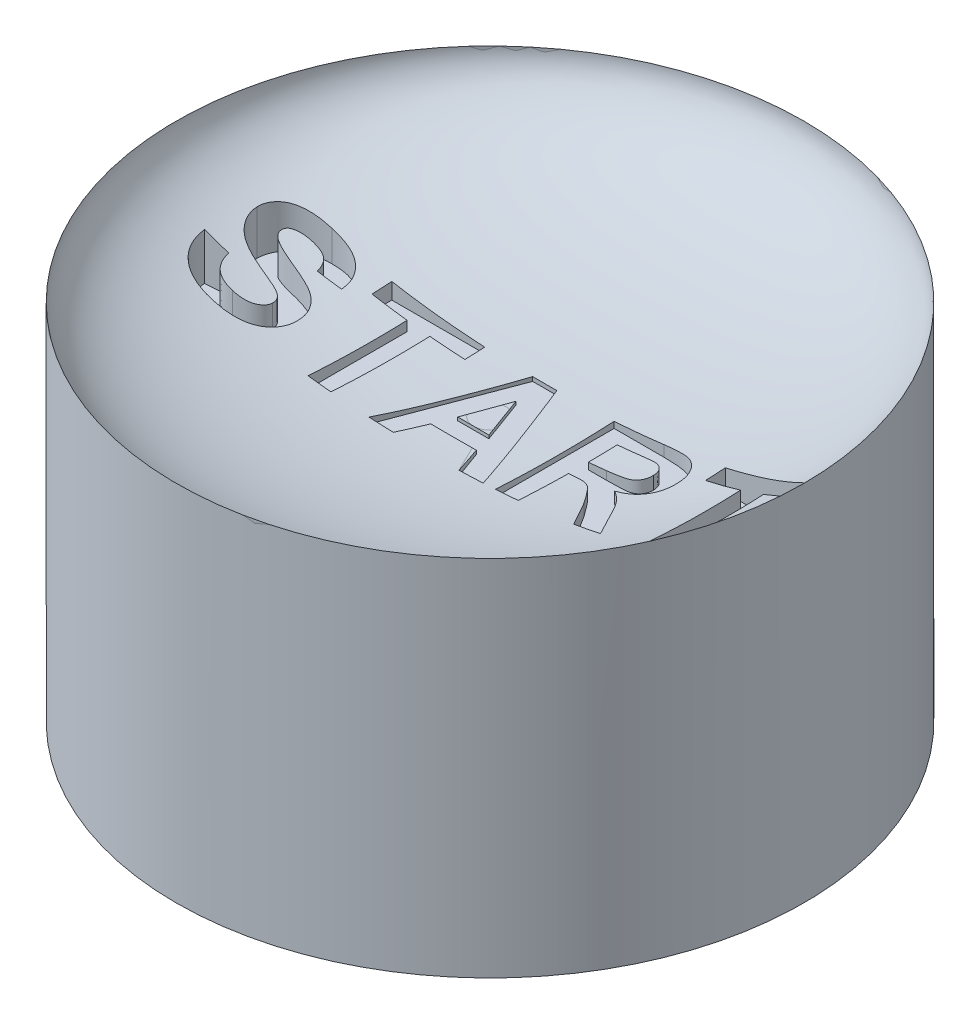
from build123d import *

# Parameters (mm, degrees)
SKETCH1_R           = 9.5
BOSS_EXTRUDE1_DEPTH = 8
CUT_EXTRUDE1_DEPTH  = 2.1


with BuildPart() as part:
    # Sketch1 → Boss-Extrude1 (new body)
    with BuildSketch(Plane(origin=(0, 0, 0), x_dir=(1, 0, 0), z_dir=(0, 1, 0))):
        with Locations(Location((0, 0, 0), (0, 0, 270))):
            Circle(SKETCH1_R)
    extrude(amount=BOSS_EXTRUDE1_DEPTH)

    # Sketch6 → Revolve4 (revolve)
    with BuildSketch(Plane(origin=(0, 0, 0), x_dir=(0, 0, -1), z_dir=(1, 0, 0)), mode=Mode.PRIVATE) as revolve4_sk:
        with BuildLine():
            Line((-9.5, 8), (-9.5, 11))
            add(Edge.make_bspline(
                [(-9.5, 11), (-9.5, 8), (-0.5, 8)],
                knots=[3.141592654, 3.141592654, 3.141592654, 4.71238898, 4.71238898, 4.71238898], degree=2, weights=[1, 0.707106781, 1]))
            Line((-0.5, 8), (-9.5, 8))
        make_face()
    revolve(revolve4_sk.sketch.rotate(Axis((0, 8, 0), (0, 1, 0)), 180), axis=Axis((0, 8, 0), (0, 1, 0)))

    # Sketch7 → Cut-Extrude1 (cut)
    # profile 1 of 5: a face of its own
    with BuildSketch(Plane(origin=(0, 10, 0), x_dir=(1, 0, 0), z_dir=(0, 1, 0))):
        with BuildLine():
            Line((-7.914500021, -0.728793614), (-7.223029606, -0.682695586))
            add(Edge.make_bspline(
                [(-7.223029606, -0.682695586), (-7.217520857, -0.711624273), (-7.206820462, -0.767816408), (-7.183046194, -0.847897872), (-7.156877305, -0.922556508), (-7.125604049, -0.990991728), (-7.091367822, -1.054468519), (-7.051356104, -1.111178579), (-7.008360214, -1.162932517), (-6.960251774, -1.207871552), (-6.907838253, -1.247229779), (-6.850858113, -1.280795787), (-6.789928782, -1.309847773), (-6.724901282, -1.333771162), (-6.655105404, -1.351630089), (-6.581149173, -1.364335656), (-6.502926521, -1.372471951), (-6.449467568, -1.373592075), (-6.422076375, -1.374166001)],
                knots=[0, 0, 0, 0, 1.204560339, 2.339781841, 3.415289417, 4.440034832, 5.416475564, 6.362424008, 7.275913008, 8.16578645, 9.05021719, 9.95355393, 10.867835453, 11.809845306, 12.784702352, 13.812224031, 14.87903166, 16, 16, 16, 16], degree=3))
            add(Edge.make_bspline(
                [(-6.422076375, -1.374166001), (-6.393245412, -1.373851457), (-6.337167703, -1.373239653), (-6.255904902, -1.365649683), (-6.179920493, -1.354776235), (-6.109885444, -1.337563822), (-6.044491916, -1.318314461), (-5.985364014, -1.291979285), (-5.931544908, -1.261605466), (-5.883173247, -1.227139051), (-5.840959253, -1.188913324), (-5.804028344, -1.149006906), (-5.771863963, -1.108281957), (-5.746548318, -1.064931282), (-5.726060706, -1.020708163), (-5.712519829, -0.974293347), (-5.703372165, -0.926752618), (-5.702323195, -0.894261771), (-5.701794692, -0.877891922)],
                knots=[0, 0, 0, 0, 1.417779877, 2.757654889, 4.012140507, 5.189587551, 6.302846416, 7.360586765, 8.365575446, 9.33904572, 10.275781718, 11.161696098, 12.012180333, 12.822428111, 13.625933072, 14.403138519, 15.195454004, 16, 16, 16, 16], degree=3))
            add(Edge.make_bspline(
                [(-5.701794692, -0.877891922), (-5.702442856, -0.857381829), (-5.703710892, -0.817256834), (-5.71897678, -0.759893758), (-5.741870438, -0.706748526), (-5.776340376, -0.658606093), (-5.822676456, -0.614610925), (-5.881782744, -0.573454522), (-5.9553091, -0.536429857), (-6.009856092, -0.515777429), (-6.03888652, -0.504786011)],
                knots=[0, 0, 0, 0, 0.90494901, 1.770400303, 2.607161909, 3.452839393, 4.36912122, 5.420987164, 6.627424851, 8, 8, 8, 8], degree=3))
            add(Edge.make_bspline(
                [(-6.03888652, -0.504786011), (-6.051342708, -0.500611885), (-6.079217633, -0.491270869), (-6.126769296, -0.477914096), (-6.184046538, -0.461235037), (-6.25187705, -0.442276623), (-6.330238024, -0.422887156), (-6.418254273, -0.399001533), (-6.51699881, -0.375233386), (-6.586080607, -0.357687745), (-6.622314683, -0.348484886)],
                knots=[0, 0, 0, 0, 0.521821638, 1.167752076, 1.961721917, 2.891982557, 3.96540661, 5.168436773, 6.514817513, 8, 8, 8, 8], degree=3))
            add(Edge.make_bspline(
                [(-6.622314683, -0.348484886), (-6.669502203, -0.336703263), (-6.760542806, -0.313972549), (-6.890387554, -0.273536219), (-7.009976942, -0.233360487), (-7.118159517, -0.189767662), (-7.216128579, -0.145712146), (-7.302299447, -0.098100951), (-7.378470319, -0.049406696), (-7.422856855, -0.01301142), (-7.444156082, 0.004453139)],
                knots=[0, 0, 0, 0, 1.293880989, 2.496331788, 3.617634808, 4.64976062, 5.598842568, 6.473791081, 7.267636666, 8, 8, 8, 8], degree=3))
            add(Edge.make_bspline(
                [(-7.444156082, 0.004453139), (-7.470569893, 0.029184276), (-7.522356612, 0.077671958), (-7.590525789, 0.157346525), (-7.64780646, 0.241509958), (-7.694954724, 0.329541017), (-7.731257995, 0.421946494), (-7.756989287, 0.518107866), (-7.773643513, 0.618276102), (-7.775342962, 0.686493044), (-7.776205938, 0.721133413)],
                knots=[0, 0, 0, 0, 1.064429417, 2.086912298, 3.078678339, 4.055528992, 5.020032834, 5.993708893, 6.981211098, 8, 8, 8, 8], degree=3))
            add(Edge.make_bspline(
                [(-7.776205938, 0.721133413), (-7.774525286, 0.765957637), (-7.771191375, 0.854875516), (-7.74061724, 0.985572662), (-7.692991091, 1.111685341), (-7.637756051, 1.211823479), (-7.584687095, 1.287578358), (-7.540617191, 1.341939367), (-7.492202143, 1.392816045), (-7.438778769, 1.438967349), (-7.38233081, 1.483096626), (-7.320671255, 1.522283952), (-7.25554834, 1.559196245), (-7.161308062, 1.602954052), (-7.033355623, 1.648553984), (-6.866882627, 1.686991833), (-6.685626499, 1.710097945), (-6.559961067, 1.712932577), (-6.494824825, 1.714401853)],
                knots=[0, 0, 0, 0, 1.180131776, 2.341029169, 3.518901375, 4.725685298, 5.343762192, 5.955650671, 6.568945152, 7.192346361, 7.815201106, 8.455999361, 9.116257477, 9.787318263, 11.192748436, 12.688084276, 14.283332633, 16, 16, 16, 16], degree=3))
            add(Edge.make_bspline(
                [(-6.494824825, 1.714401853), (-6.441491214, 1.713688649), (-6.337758482, 1.712301482), (-6.187385837, 1.698274232), (-6.046929628, 1.676442475), (-5.916882732, 1.645103089), (-5.797184557, 1.603695536), (-5.687371117, 1.55437131), (-5.587535726, 1.495811078), (-5.498893783, 1.427678782), (-5.419922309, 1.352567295), (-5.351032327, 1.270523752), (-5.291960457, 1.182584313), (-5.242325458, 1.088813242), (-5.203347224, 0.98872842), (-5.174719249, 0.882454732), (-5.155784459, 0.77024232), (-5.151038396, 0.693353255), (-5.14861836, 0.654147216)],
                knots=[0, 0, 0, 0, 1.325124071, 2.577337985, 3.749592149, 4.855247722, 5.896868755, 6.892903601, 7.842551483, 8.766257401, 9.665194363, 10.546067736, 11.423174165, 12.293291263, 13.177512979, 14.086532529, 15.024315359, 16, 16, 16, 16], degree=3))
            Line((-5.14861836, 0.654147216), (-5.840088775, 0.608049189))
            add(Edge.make_bspline(
                [(-5.840088775, 0.608049189), (-5.844077694, 0.629731847), (-5.85185168, 0.671989091), (-5.868754456, 0.732510051), (-5.887819968, 0.788485036), (-5.910135161, 0.839913687), (-5.937089218, 0.885874868), (-5.966422978, 0.927814542), (-5.998945625, 0.965173886), (-6.035733999, 0.996929882), (-6.075523891, 1.025826536), (-6.120870344, 1.048987874), (-6.169873294, 1.070476497), (-6.224397003, 1.086630672), (-6.28339442, 1.099444744), (-6.34689991, 1.108944264), (-6.41504511, 1.113582464), (-6.461926496, 1.114600694), (-6.486181445, 1.115127493)],
                knots=[0, 0, 0, 0, 1.151066407, 2.24330871, 3.278475654, 4.238599069, 5.165719782, 6.056502506, 6.909492653, 7.744782051, 8.590364415, 9.471203867, 10.39832458, 11.382154319, 12.435022857, 13.550631277, 14.73277401, 16, 16, 16, 16], degree=3))
            add(Edge.make_bspline(
                [(-6.486181445, 1.115127493), (-6.511399967, 1.114662416), (-6.560463728, 1.113757587), (-6.631962706, 1.108204784), (-6.699034111, 1.097954846), (-6.762007351, 1.084611968), (-6.820798308, 1.066459906), (-6.875282916, 1.04432644), (-6.925710444, 1.018268537), (-6.956458952, 0.997767078), (-6.971651299, 0.987637635)],
                knots=[0, 0, 0, 0, 1.186678824, 2.308736671, 3.37120409, 4.377216403, 5.334874112, 6.262130804, 7.141346615, 8, 8, 8, 8], degree=3))
            add(Edge.make_bspline(
                [(-6.971651299, 0.987637635), (-6.989037663, 0.973800529), (-7.022709655, 0.947002348), (-7.058947843, 0.893790272), (-7.080763316, 0.833688827), (-7.083389056, 0.791187012), (-7.084735523, 0.769392286)],
                knots=[0, 0, 0, 0, 1.037857257, 2.010007357, 2.979541333, 4, 4, 4, 4], degree=3))
            add(Edge.make_bspline(
                [(-7.084735523, 0.769392286), (-7.083634358, 0.749023667), (-7.08146524, 0.708900729), (-7.059586888, 0.651905227), (-7.025940963, 0.599094795), (-6.994504364, 0.570407476), (-6.978133834, 0.555468626)],
                knots=[0, 0, 0, 0, 0.98538058, 1.941042925, 2.927803204, 4, 4, 4, 4], degree=3))
            add(Edge.make_bspline(
                [(-6.978133834, 0.555468626), (-6.965141708, 0.545772563), (-6.936109716, 0.524105897), (-6.88292886, 0.496565516), (-6.818738171, 0.466737619), (-6.742074257, 0.437577556), (-6.653446624, 0.408471622), (-6.552849882, 0.378081662), (-6.440222161, 0.347283689), (-6.318434285, 0.31745736), (-6.19478529, 0.288139792), (-6.076790461, 0.256087416), (-5.967072238, 0.224838828), (-5.866139354, 0.192085237), (-5.773471518, 0.160199717), (-5.689518877, 0.127450992), (-5.613704981, 0.095557399), (-5.525297573, 0.051701448), (-5.425096668, -0.007703209), (-5.320074816, -0.094057786), (-5.227196389, -0.19112597), (-5.16248117, -0.282654571), (-5.1180252, -0.361371604), (-5.089400247, -0.424118246), (-5.064637417, -0.490237384), (-5.04448054, -0.559802086), (-5.029871655, -0.632910237), (-5.017781952, -0.70900329), (-5.011605099, -0.788713216), (-5.010755813, -0.843069714), (-5.010324277, -0.870689105)],
                knots=[0, 0, 0, 0, 0.511875881, 1.143829537, 1.88775736, 2.750598373, 3.734912702, 4.837306479, 6.073130119, 7.42648979, 8.801963576, 10.091065733, 11.292408984, 12.408830014, 13.446061236, 14.39066453, 15.257936293, 16.045629259, 17.510392066, 18.929669597, 20.331293837, 21.746891395, 22.460690638, 23.187651344, 23.925159671, 24.69163991, 25.474819891, 26.281170188, 27.126635539, 28, 28, 28, 28], degree=3))
            add(Edge.make_bspline(
                [(-5.010324277, -0.870689105), (-5.010917653, -0.896160359), (-5.012096039, -0.946743801), (-5.020330919, -1.0218224), (-5.033065956, -1.095567741), (-5.051918185, -1.168072274), (-5.076927592, -1.239193367), (-5.105086196, -1.309957494), (-5.140296945, -1.378821438), (-5.180371579, -1.445842235), (-5.224575722, -1.510969591), (-5.274667227, -1.571048094), (-5.327703914, -1.628082107), (-5.387074686, -1.678878043), (-5.449113265, -1.727548878), (-5.516657232, -1.770652587), (-5.588124129, -1.809657628), (-5.66396583, -1.844272788), (-5.744451235, -1.874436772), (-5.829475811, -1.901284814), (-5.919805577, -1.923257874), (-6.014687313, -1.942091555), (-6.114468243, -1.956414083), (-6.219023619, -1.966414537), (-6.32837721, -1.972054191), (-6.402862579, -1.972972564), (-6.440803699, -1.973440361)],
                knots=[0, 0, 0, 0, 0.900570041, 1.788444861, 2.667795364, 3.545012114, 4.433698372, 5.332345486, 6.235991676, 7.164928091, 8.092777575, 9.015680987, 9.928493428, 10.842962589, 11.775229507, 12.714851019, 13.672254427, 14.652424454, 15.660007982, 16.709910502, 17.803296389, 18.945495772, 20.129342395, 21.366102753, 22.658353839, 24, 24, 24, 24], degree=3))
            add(Edge.make_bspline(
                [(-6.440803699, -1.973440361), (-6.495584821, -1.972545966), (-6.602244966, -1.970804558), (-6.757203, -1.955217584), (-6.902543377, -1.931360597), (-7.038029495, -1.89673606), (-7.163826951, -1.85228597), (-7.279878369, -1.797533275), (-7.385622422, -1.732150855), (-7.482368807, -1.657724345), (-7.568828531, -1.572897506), (-7.646573288, -1.479427918), (-7.714554281, -1.376473903), (-7.772726825, -1.264196495), (-7.822561624, -1.143202664), (-7.863660863, -1.013436852), (-7.894606429, -0.874280145), (-7.907754137, -0.778127854), (-7.914500021, -0.728793614)],
                knots=[0, 0, 0, 0, 1.217954099, 2.371385517, 3.459848295, 4.490682126, 5.476952527, 6.422732854, 7.338496285, 8.236688651, 9.131557988, 10.026443255, 10.935708282, 11.869506048, 12.834296687, 13.842423496, 14.892981177, 16, 16, 16, 16], degree=3))
        make_face()
    # profile 2 of 5: a face of its own
    with BuildSketch(Plane(origin=(0, 10, 0), x_dir=(1, 0, 0), z_dir=(0, 1, 0))):
        Polygon((-3.581285419, -1.927342333), (-3.581285419, 1.069029466), (-4.641540056, 1.069029466), (-4.641540056, 1.668303825), (-1.829560367, 1.668303825), (-1.829560367, 1.069029466), (-2.889815004, 1.069029466), (-2.889815004, -1.927342333), align=None)
    # profile 3 of 5: a face of its own
    with BuildSketch(Plane(origin=(0, 10, 0), x_dir=(1, 0, 0), z_dir=(0, 1, 0))):
        Polygon((1.719987764, -1.927342333), (0.986741011, -1.927342333), (0.683502423, -1.097577835), (-0.696557281, -1.097577835), (-0.999795869, -1.927342333), (-1.737364312, -1.927342333), (-0.378192777, 1.668303825), (0.354333694, 1.668303825), align=None)
        Polygon((0.46381651, -0.498303475), (-0.008688274, 0.7924413), (-0.479752495, -0.498303475), align=None, mode=Mode.SUBTRACT)
    # profile 4 of 5: a face of its own
    with BuildSketch(Plane(origin=(0, 10, 0), x_dir=(1, 0, 0), z_dir=(0, 1, 0))):
        with BuildLine():
            Line((2.088771985, -1.927342333), (2.088771985, 1.668303825))
            Line((2.088771985, 1.668303825), (3.59776211, 1.668303825))
            add(Edge.make_bspline(
                [(3.59776211, 1.668303825), (3.643621811, 1.668021193), (3.732001849, 1.667476509), (3.859816626, 1.663504563), (3.977690541, 1.655183106), (4.086146485, 1.645758986), (4.184663534, 1.6320475), (4.273631208, 1.615621275), (4.352899723, 1.596585545), (4.423625654, 1.573787171), (4.488113335, 1.54769364), (4.548186775, 1.516634996), (4.604506497, 1.480245978), (4.657937518, 1.439780815), (4.708706096, 1.39517733), (4.755420427, 1.345255096), (4.798894399, 1.290757469), (4.839092933, 1.232137874), (4.874505324, 1.169655151), (4.906862953, 1.105315948), (4.933203284, 1.038435597), (4.954960157, 0.969329157), (4.972339883, 0.898146665), (4.984402882, 0.82470715), (4.991933682, 0.74914354), (4.992605957, 0.698102513), (4.992947729, 0.672154259)],
                knots=[0, 0, 0, 0, 1.675828044, 3.229627355, 4.67171229, 5.993455049, 7.206927059, 8.304770529, 9.29850117, 10.183580433, 11.017754134, 11.837875825, 12.650738409, 13.464925643, 14.285328857, 15.117007378, 15.959673368, 16.830859064, 17.711229498, 18.58228265, 19.460420693, 20.334473227, 21.228207035, 22.135446768, 23.052097822, 24, 24, 24, 24], degree=3))
            add(Edge.make_bspline(
                [(4.992947729, 0.672154259), (4.992313794, 0.639466721), (4.99107491, 0.575586262), (4.979674045, 0.481957391), (4.962740848, 0.392501687), (4.938602707, 0.307095219), (4.905413255, 0.226742488), (4.866884357, 0.150317867), (4.820932175, 0.078080591), (4.767868901, 0.010746779), (4.707742044, -0.05174317), (4.640288101, -0.108103263), (4.565988675, -0.158553767), (4.484394298, -0.202803754), (4.396073117, -0.240632699), (4.300642142, -0.27246082), (4.19853339, -0.298365365), (4.127506598, -0.310554227), (4.091155062, -0.316792491)],
                knots=[0, 0, 0, 0, 1.05911256, 2.069797862, 3.05271628, 4.008392045, 4.940519534, 5.866323021, 6.779546087, 7.71056835, 8.640711998, 9.585328432, 10.554502533, 11.547017206, 12.589327225, 13.664782803, 14.804835066, 16, 16, 16, 16], degree=3))
            add(Edge.make_bspline(
                [(4.091155062, -0.316792491), (4.12631108, -0.340076652), (4.195116195, -0.385646928), (4.290313026, -0.460701742), (4.375777192, -0.539477575), (4.440486348, -0.609529945), (4.490208665, -0.67113348), (4.530243626, -0.725012526), (4.573427749, -0.787019492), (4.619337492, -0.857187975), (4.669330065, -0.934897151), (4.721546152, -1.021336478), (4.777078451, -1.115662815), (4.81441512, -1.181554536), (4.833765477, -1.215704031)],
                knots=[0, 0, 0, 0, 1.285445069, 2.515791127, 3.691898215, 4.826622834, 5.420063933, 6.105349801, 6.873086501, 7.723915395, 8.66222816, 9.690593598, 10.803111229, 12, 12, 12, 12], degree=3))
            Line((4.833765477, -1.215704031), (5.269535895, -1.927342333))
            Line((5.269535895, -1.927342333), (4.461379847, -1.927342333))
            Line((4.461379847, -1.927342333), (3.949979853, -1.111263187))
            add(Edge.make_bspline(
                [(3.949979853, -1.111263187), (3.926493316, -1.078579806), (3.881652689, -1.016180513), (3.816922475, -0.927509092), (3.757700073, -0.848575602), (3.70556159, -0.778236735), (3.65786884, -0.718486765), (3.616069966, -0.668284457), (3.581016357, -0.626552541), (3.54135311, -0.585173546), (3.495209134, -0.542647465), (3.438086577, -0.501416009), (3.379427011, -0.468546727), (3.316577972, -0.443466692), (3.243894956, -0.425979225), (3.156518461, -0.414837486), (3.051701166, -0.406617236), (2.975939261, -0.406285974), (2.935102962, -0.40610742)],
                knots=[0, 0, 0, 0, 1.465447777, 2.797841088, 3.997266218, 5.05856206, 5.985598736, 6.780315439, 7.437430484, 7.969193402, 8.866571936, 9.718200644, 10.52825214, 11.309096006, 12.174169268, 13.242355782, 14.513606761, 16, 16, 16, 16], degree=3))
            Line((2.935102962, -0.40610742), (2.7802424, -0.40610742))
            Line((2.7802424, -0.40610742), (2.7802424, -1.927342333))
            Line((2.7802424, -1.927342333), (2.088771985, -1.927342333))
        make_face()
        with BuildLine():
            Line((2.7802424, 0.19316694), (3.337020141, 0.19316694))
            add(Edge.make_bspline(
                [(3.337020141, 0.19316694), (3.379999023, 0.193259046), (3.461881056, 0.193434524), (3.578318936, 0.195976255), (3.68233717, 0.198133569), (3.773313287, 0.203553912), (3.851654323, 0.208925982), (3.91704601, 0.215907725), (3.970039293, 0.22415992), (4.022970676, 0.236989916), (4.077190397, 0.25934365), (4.134978361, 0.291181949), (4.184368303, 0.332484857), (4.227151401, 0.380235195), (4.259788911, 0.43637006), (4.285351801, 0.49838858), (4.298312728, 0.567668863), (4.300400349, 0.615689121), (4.301477314, 0.640461865)],
                knots=[0, 0, 0, 0, 1.697953026, 3.23488743, 4.60134403, 5.807846676, 6.835100678, 7.703488618, 8.405232423, 8.952775585, 9.851109663, 10.713519226, 11.549115941, 12.382556273, 13.233359028, 14.101746968, 15.020727134, 16, 16, 16, 16], degree=3))
            add(Edge.make_bspline(
                [(4.301477314, 0.640461865), (4.300252469, 0.6681753), (4.297889329, 0.721643905), (4.279253268, 0.797730239), (4.246724784, 0.86494204), (4.20205083, 0.923390276), (4.145969717, 0.972744809), (4.07917091, 1.011921566), (4.002150677, 1.041098789), (3.946598712, 1.051873881), (3.917567177, 1.057504959)],
                knots=[0, 0, 0, 0, 1.062977961, 2.050844577, 2.982300261, 3.90936959, 4.856017476, 5.831122378, 6.86654153, 8, 8, 8, 8], degree=3))
            add(Edge.make_bspline(
                [(3.917567177, 1.057504959), (3.907970774, 1.058559397), (3.885225283, 1.061058638), (3.845059443, 1.06266379), (3.793702264, 1.065131084), (3.730532119, 1.066139413), (3.656113365, 1.067906923), (3.57015008, 1.068231482), (3.472915378, 1.069268427), (3.404246847, 1.069112035), (3.367992253, 1.069029466)],
                knots=[0, 0, 0, 0, 0.42127143, 0.998501726, 1.753681744, 2.66564073, 3.755712164, 5.002818897, 6.417592707, 8, 8, 8, 8], degree=3))
            Line((3.367992253, 1.069029466), (2.7802424, 1.069029466))
            Line((2.7802424, 1.069029466), (2.7802424, 0.19316694))
        make_face(mode=Mode.SUBTRACT)
    # profile 5 of 5: a face of its own
    with BuildSketch(Plane(origin=(0, 10, 0), x_dir=(1, 0, 0), z_dir=(0, 1, 0))):
        Polygon((6.514182642, -1.927342333), (6.514182642, 1.069029466), (5.453928006, 1.069029466), (5.453928006, 1.668303825), (8.265907694, 1.668303825), (8.265907694, 1.069029466), (7.205653057, 1.069029466), (7.205653057, -1.927342333), align=None)
    extrude(amount=-CUT_EXTRUDE1_DEPTH, mode=Mode.SUBTRACT)


solid = part.part
